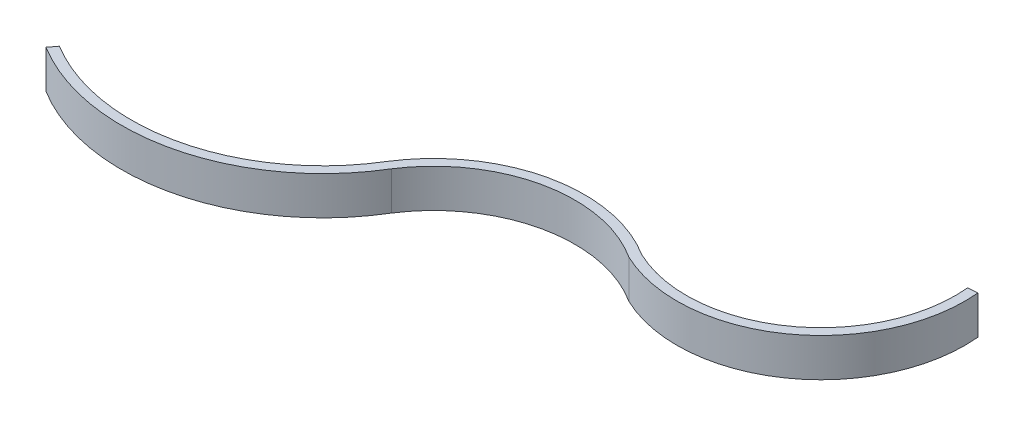
from build123d import *

# Parameters (mm, degrees)
BOSS_EXTRUDE1_DEPTH = 200


with BuildPart() as part:
    # Sketch2 → Boss-Extrude1 (new body)
    with BuildSketch(Plane(origin=(0, 0, 0), x_dir=(1, 0, 0), z_dir=(0, 1, 0))):
        with BuildLine():
            Line((-3459.439073928, -1276.336362632), (-3489.707759408, -1316.13343136))
            ThreePointArc((-3489.707759408, -1316.13343136), (-2691.475954235, -1442.576449994), (-2039.963649032, -964.35728693))
            ThreePointArc((-2039.963649032, -964.35728693), (-1576.279248466, -643.463787191), (-1021.498894791, -744.432201458))
            ThreePointArc((-1021.498894791, -744.432201458), (-267.721948853, -681.807700997), (49.778459986, 4.701587121))
            Line((49.778459986, 4.701587121), (0, 0))
            ThreePointArc((0, 0), (-296.375544039, -640.832446478), (-1000, -699.290230713))
            ThreePointArc((-1000, -699.290230713), (-1592.997427802, -596.341579267), (-2085.105619778, -942.85839214))
            ThreePointArc((-2085.105619778, -942.85839214), (-2703.206797788, -1394.231155352), (-3459.439073928, -1276.336362632))
        make_face()
    extrude(amount=BOSS_EXTRUDE1_DEPTH)


solid = part.part
